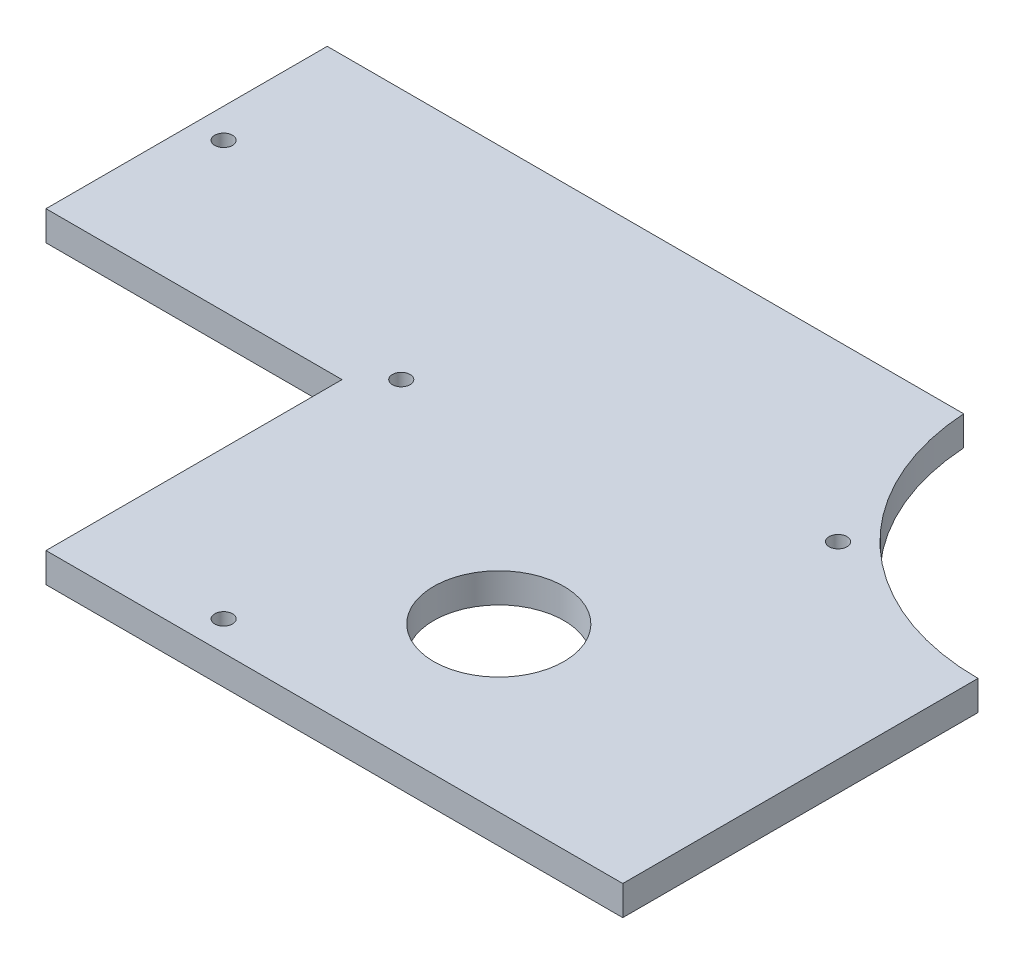
from build123d import *

# Parameters (mm, degrees)
ESQUISSE1_R        = 1.5
ESQUISSE1_R_2      = 11
BOSS_EXTRU_1_DEPTH = 5


with BuildPart() as part:
    # Esquisse1 → Boss.-Extru.1 (new body)
    with BuildSketch(Plane(origin=(0, 0, 0), x_dir=(1, 0, 0), z_dir=(0, 1, 0))):
        with BuildLine():
            Line((-97.415, -97.415), (0, -97.415))
            Line((0, -97.415), (0, -37.415))
            ThreePointArc((0, -37.415), (-27.386127875, -26.569759474), (-39.921798557, 0.085))
            Line((-39.921798557, 0.085), (-147.415, 0.085))
            Line((-147.415, 0.085), (-147.415, -47.415))
            Line((-147.415, -47.415), (-97.415, -47.415))
            Line((-97.415, -47.415), (-97.415, -97.415))
        make_face()
        with Locations(Location((-72.415, -92.415, 0), (0, 0, 270))):
            Circle(ESQUISSE1_R, mode=Mode.SUBTRACT)
        with Locations(Location((-48.43544943, -69.915, 0), (0, 0, 270))):
            Circle(ESQUISSE1_R_2, mode=Mode.SUBTRACT)
        with Locations(Location((-142.415, -22.415, 0), (0, 0, 270))):
            Circle(ESQUISSE1_R, mode=Mode.SUBTRACT)
        with Locations(Location((-92.415, -42.415, 0), (0, 0, 270))):
            Circle(ESQUISSE1_R, mode=Mode.SUBTRACT)
        with Locations(Location((-31.819805153, -29.234805153, 0), (0, 0, 270))):
            Circle(ESQUISSE1_R, mode=Mode.SUBTRACT)
    extrude(amount=BOSS_EXTRU_1_DEPTH)


solid = part.part
